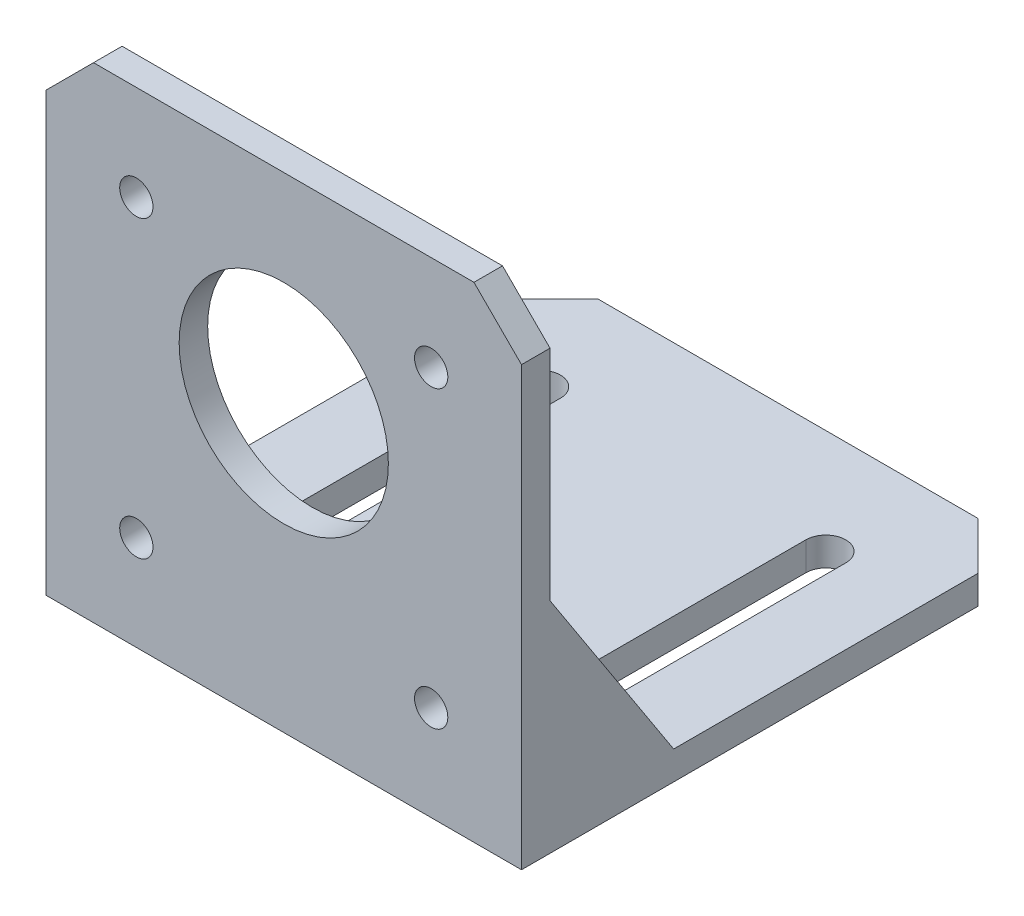
from build123d import *

# Parameters (mm, degrees)
SKETCH_1_W          = 50
SKETCH_1_H          = 51
SKETCH_1_R          = 11
SKETCH_1_R_2        = 1.75
EXTRUDE_1_DEPTH     = 3
CHAMFER_1_SIZE      = 5
SKETCH_2_W          = 50
SKETCH_2_H          = 3
EXTRUDE_2_DEPTH     = 50
CHAMFER_2_SIZE      = 5
CUT_EXTRUDE_1_DEPTH = 50
EXTRUDE_3_DEPTH     = 3
EXTRUDE_4_DEPTH     = 3


with BuildPart() as part:
    # 草图1 → 凸台-拉伸1 (new body)
    with BuildSketch(Plane.XY):
        Rectangle(SKETCH_1_W, SKETCH_1_H)
        with Locations((0, 4.5)):
            Circle(SKETCH_1_R, mode=Mode.SUBTRACT)
        with Locations((-15.5, 15.5)):
            Circle(SKETCH_1_R_2, mode=Mode.SUBTRACT)
        with Locations(Location((-15.5, -15.5, 0), (0, 0, 180))):
            Circle(SKETCH_1_R_2, mode=Mode.SUBTRACT)
        with Locations((15.5, -15.5)):
            Circle(SKETCH_1_R_2, mode=Mode.SUBTRACT)
        with Locations(Location((15.5, 15.5, 0), (0, 0, 180))):
            Circle(SKETCH_1_R_2, mode=Mode.SUBTRACT)
    extrude(amount=EXTRUDE_1_DEPTH)

    # 倒角1
    chamfer_1_edges = [part.edges().sort_by_distance(p)[0] for p in [
        (-25, 25.5, 1.5),
        (25, 25.5, 1.5),
    ]]
    chamfer(chamfer_1_edges, length=CHAMFER_1_SIZE)

    # 草图2 → 凸台-拉伸2 (add)
    with BuildSketch(Plane(origin=(0, 0, 0), x_dir=(-1, 0, 0), z_dir=(0, 0, -1))):
        with Locations((0, -24)):
            Rectangle(SKETCH_2_W, SKETCH_2_H)
    extrude(amount=EXTRUDE_2_DEPTH)

    # 倒角2
    chamfer_2_edges = [part.edges().sort_by_distance(p)[0] for p in [
        (-25, -24, -50),
        (25, -24, -50),
    ]]
    chamfer(chamfer_2_edges, length=CHAMFER_2_SIZE)

    # 草图3 → 切除-拉伸1 (cut)
    with BuildSketch(Plane(origin=(0, -22.5, 0), x_dir=(1, 0, 0), z_dir=(0, 1, 0))):
        with BuildLine():
            Line((-17.1, 39), (-17.1, 9))
            ThreePointArc((-17.1, 9), (-15, 6.9), (-12.9, 9))
            Line((-12.9, 9), (-12.9, 39))
            ThreePointArc((-12.9, 39), (-15, 41.1), (-17.1, 39))
        make_face()
        with BuildLine():
            Line((12.9, 39), (12.9, 9))
            ThreePointArc((12.9, 9), (15, 6.9), (17.1, 9))
            Line((17.1, 9), (17.1, 39))
            ThreePointArc((17.1, 39), (15, 41.1), (12.9, 39))
        make_face()
    extrude(amount=-CUT_EXTRUDE_1_DEPTH, mode=Mode.SUBTRACT)

    # 草图4 → 凸台-拉伸3 (add)
    with BuildSketch(Plane(origin=(25, 0, 0), x_dir=(0, 0, -1), z_dir=(1, 0, 0))):
        Polygon((0, -2.5), (13, -22.5), (0, -22.5), align=None)
    extrude(amount=-EXTRUDE_3_DEPTH)

    # 草图5 → 凸台-拉伸4 (add)
    with BuildSketch(Plane.ZY.offset(25)):
        Polygon((0, -22.5), (0, -2.5), (-13, -22.5), align=None)
    extrude(amount=-EXTRUDE_4_DEPTH)


solid = part.part
